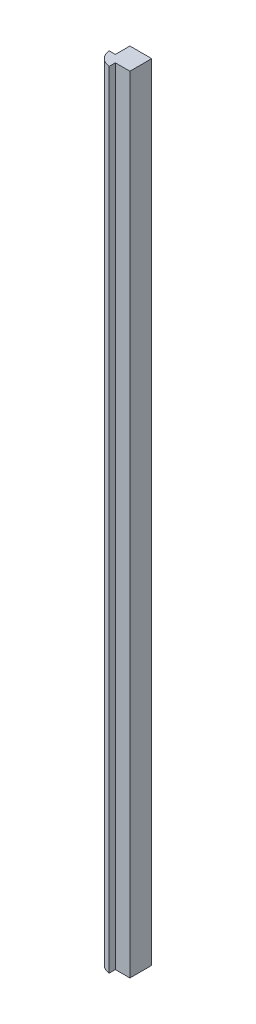
from build123d import *

# Parameters (mm, degrees)
BOSS_EXTRUDE1_DEPTH = 342.9


with BuildPart() as part:
    # Sketch1 → Boss-Extrude1 (new body)
    with BuildSketch(Plane(origin=(0, 0, 0), x_dir=(1, 0, 0), z_dir=(0, 1, 0))):
        with BuildLine():
            Line((3.175, 12.7), (12.7, 12.7))
            Line((12.7, 12.7), (12.7, 3.175))
            Line((12.7, 3.175), (6.35, 3.175))
            Line((6.35, 3.175), (6.35, 0.508))
            ThreePointArc((6.35, 0.508), (2.349005221, 2.349005221), (0.508, 6.35))
            Line((0.508, 6.35), (3.175, 6.35))
            Line((3.175, 6.35), (3.175, 12.7))
        make_face()
    extrude(amount=BOSS_EXTRUDE1_DEPTH)


solid = part.part
